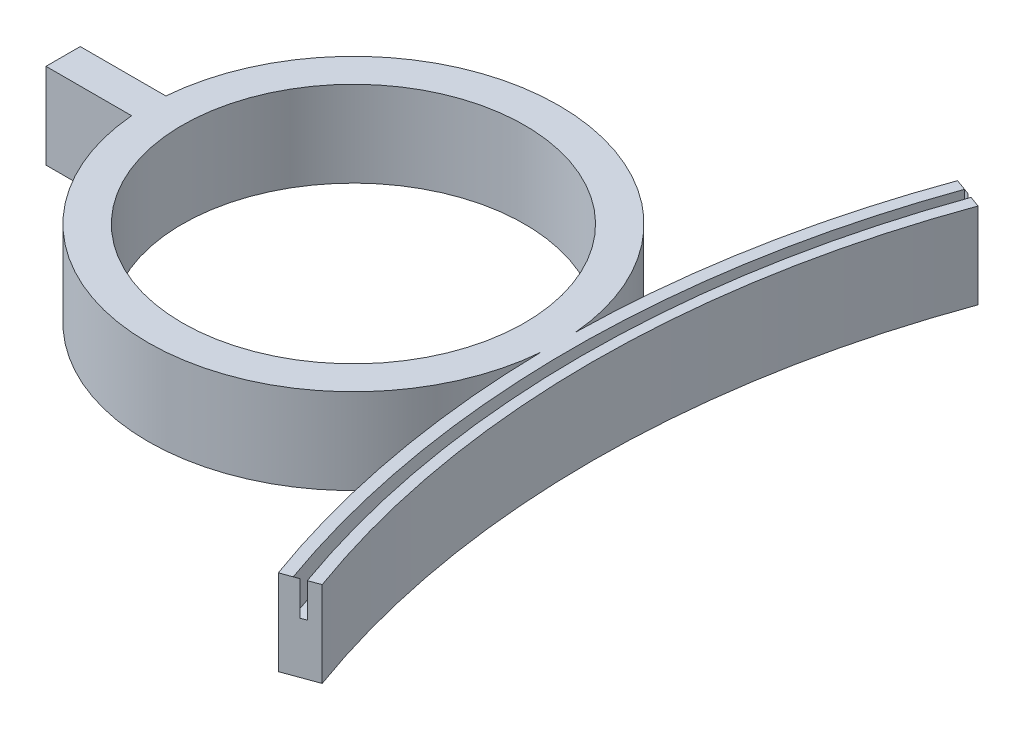
from build123d import *

# Parameters (mm, degrees)
SKETCH1_R           = 12.7
BOSS_EXTRUDE1_DEPTH = 6.35
CUT_EXTRUDE1_DEPTH  = 2.54


with BuildPart() as part:
    # Sketch1 → Boss-Extrude1 (new body)
    with BuildSketch(Plane(origin=(0, 0, 0), x_dir=(1, 0, 0), z_dir=(0, 1, 0))):
        with BuildLine():
            Line((-21.536991144, 1.27), (-21.536991144, -1.27))
            Line((-21.536991144, -1.27), (-15.186991144, -1.27))
            ThreePointArc((-15.186991144, -1.27), (0, -15.24), (15.186991144, -1.27))
            ThreePointArc((15.186991144, -1.27), (16.408069395, -13.415825599), (19.618283607, -25.193203757))
            Line((19.618283607, -25.193203757), (22.005102864, -24.324472593))
            ThreePointArc((22.005102864, -24.324472593), (17.716042054, 0), (22.005102864, 24.324472593))
            Line((22.005102864, 24.324472593), (19.618283607, 25.193203757))
            ThreePointArc((19.618283607, 25.193203757), (16.408069395, 13.415825599), (15.186991144, 1.27))
            ThreePointArc((15.186991144, 1.27), (0, 15.24), (-15.186991144, 1.27))
            Line((-15.186991144, 1.27), (-21.536991144, 1.27))
        make_face()
        with Locations(Location((0, 0, 0), (0, 0, 270))):
            Circle(SKETCH1_R, mode=Mode.SUBTRACT)
    extrude(amount=BOSS_EXTRUDE1_DEPTH)

    # Sketch2 → Cut-Extrude1 (cut)
    with BuildSketch(Plane(origin=(0, 6.35, 0), x_dir=(1, 0, 0), z_dir=(0, 1, 0))):
        with BuildLine():
            Line((20.428988318, 24.895578462), (21.194398153, 24.622097889))
            ThreePointArc((21.194398153, 24.622097889), (16.927750399, 0), (21.194398153, -24.622097889))
            Line((21.194398153, -24.622097889), (20.428988318, -24.895578462))
            ThreePointArc((20.428988318, -24.895578462), (16.114950399, 0), (20.428988318, 24.895578462))
        make_face()
    extrude(amount=-CUT_EXTRUDE1_DEPTH, mode=Mode.SUBTRACT)


solid = part.part
